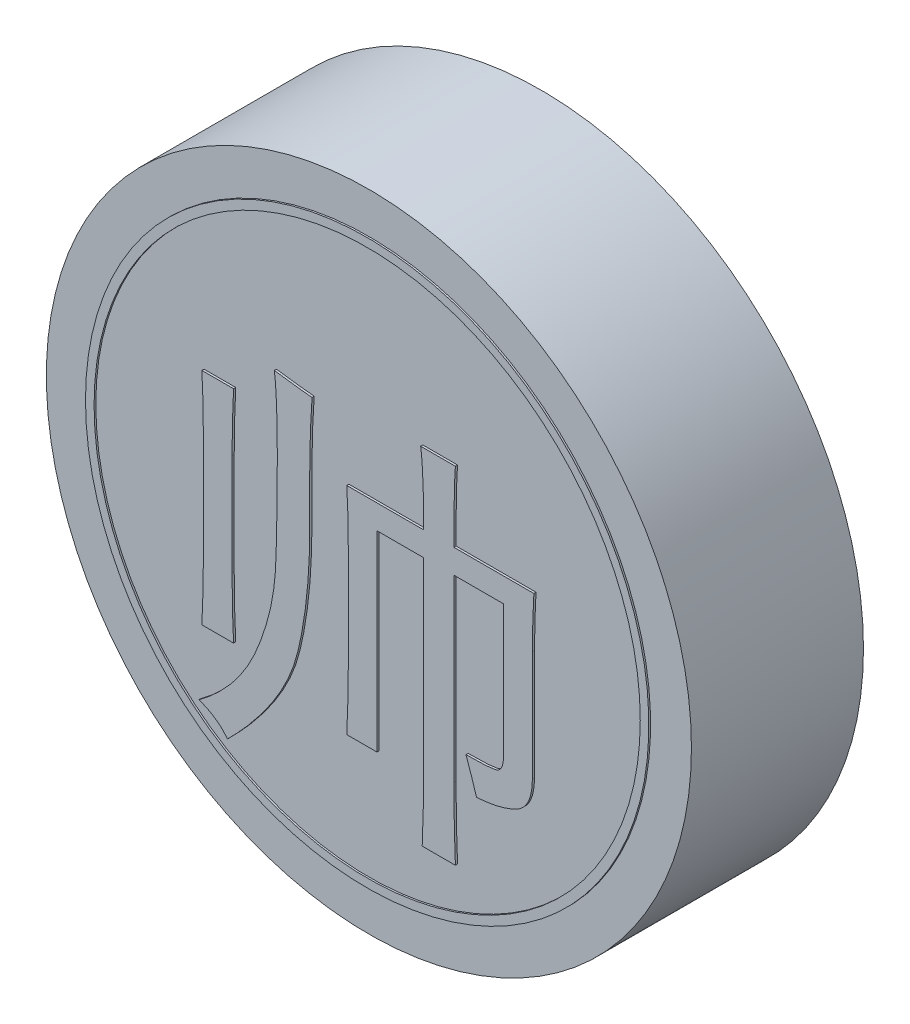
from build123d import *

# Parameters (mm, degrees)
SKETCH_1_R               = 15
DIAMETER30_HEIGHT8_DEPTH = 8
CHARACTER_DEPTH          = 0.1
SKETCH_3_R               = 13.1
SKETCH_3_R_2             = 12.7
INK_RING_DEPTH           = 0.08


with BuildPart() as part:
    # 草图1 → Diameter30_Height8 (new body)
    with BuildSketch(Plane.XY):
        Circle(SKETCH_1_R)
    extrude(amount=-DIAMETER30_HEIGHT8_DEPTH)

    # 草图2 → Character_帅 (add)
    with BuildSketch(Plane.XY):
        with BuildLine():
            add(Edge.make_bspline(
                [(2.649122807, 2.657894737), (2.648277509, 2.838961546), (2.646647548, 3.188106947), (2.643949337, 3.693304246), (2.627710858, 4.161013978), (2.618261471, 4.592706352), (2.59561766, 4.986803608), (2.573364544, 5.343905172), (2.545932395, 5.6629896), (2.520624442, 5.862638482), (2.50877193, 5.956140351)],
                knots=[0, 0, 0, 0, 1.315583411, 2.536797873, 3.670260287, 4.715635349, 5.673736592, 6.537953599, 7.315277556, 8, 8, 8, 8], degree=3))
            Line((2.50877193, 5.956140351), (4.122807018, 5.956140351))
            add(Edge.make_bspline(
                [(4.122807018, 5.956140351), (4.117499898, 5.877309705), (4.105781963, 5.703254378), (4.089167905, 5.417436401), (4.081123846, 5.081109437), (4.069497803, 4.693902375), (4.062208699, 4.256354693), (4.058010495, 3.768573009), (4.051072159, 3.230576781), (4.052096052, 2.854561793), (4.052631579, 2.657894737)],
                knots=[0, 0, 0, 0, 0.574688494, 1.268892212, 2.082186167, 3.021459211, 4.086593269, 5.265055303, 6.569542337, 8, 8, 8, 8], degree=3))
            Line((4.052631579, 2.657894737), (7.771929825, 2.657894737))
            add(Edge.make_bspline(
                [(7.771929825, 2.657894737), (7.760796072, 2.449999982), (7.73890673, 2.041271737), (7.719157498, 1.435549924), (7.705407242, 0.848123825), (7.702957274, 0.461670931), (7.701754386, 0.271929825)],
                knots=[0, 0, 0, 0, 1.046485867, 2.057427233, 3.046233291, 4, 4, 4, 4], degree=3))
            Line((7.701754386, 0.271929825), (7.701754386, -4.850877193))
            add(Edge.make_bspline(
                [(7.701754386, -4.850877193), (7.700509851, -4.946341409), (7.69812364, -5.129379766), (7.659319509, -5.390999722), (7.605347303, -5.628411903), (7.522536164, -5.840237206), (7.420768732, -6.029019154), (7.289859981, -6.189160821), (7.140756422, -6.328733562), (6.901013102, -6.472408104), (6.563626246, -6.612761018), (6.121927666, -6.749793211), (5.6299881, -6.842128832), (5.284963987, -6.870952514), (5.105263158, -6.885964912)],
                knots=[0, 0, 0, 0, 0.91195479, 1.748536932, 2.524193789, 3.235017793, 3.917413987, 4.565660724, 5.204897301, 5.860042995, 7.225363373, 8.690313679, 10.276197647, 12, 12, 12, 12], degree=3))
            add(Edge.make_bspline(
                [(5.105263158, -6.885964912), (5.030622329, -6.645449861), (4.877118075, -6.150813287), (4.703323003, -5.662931781), (4.614035088, -5.412280702)],
                knots=[0, 0, 0, 0, 0.972491982, 2, 2, 2, 2], degree=3))
            add(Edge.make_bspline(
                [(4.614035088, -5.412280702), (4.703272413, -5.411616614), (4.873964221, -5.410346357), (5.116579774, -5.405384501), (5.334043291, -5.397378419), (5.526579613, -5.38822529), (5.693812444, -5.372515338), (5.836088174, -5.354724862), (5.952359909, -5.334162259), (6.04894766, -5.312443399), (6.128856661, -5.275644675), (6.193160306, -5.21721386), (6.247720931, -5.142694696), (6.295806352, -5.050517957), (6.327140956, -4.938045189), (6.350107, -4.808315534), (6.366009975, -4.660655055), (6.367588242, -4.555491891), (6.368421053, -4.5)],
                knots=[0, 0, 0, 0, 1.810479571, 3.463057961, 4.922871987, 6.225442376, 7.372781237, 8.329861336, 9.133212, 9.768407665, 10.334419243, 10.894946083, 11.510128595, 12.201898471, 12.991479159, 13.867141808, 14.874545699, 16, 16, 16, 16], degree=3))
            Line((6.368421053, -4.5), (6.368421053, 1.535087719))
            Line((6.368421053, 1.535087719), (4.052631579, 1.535087719))
            Line((4.052631579, 1.535087719), (4.052631579, -6.815789474))
            add(Edge.make_bspline(
                [(4.052631579, -6.815789474), (4.053765197, -7.103428128), (4.056001813, -7.670936452), (4.069634056, -8.508736417), (4.088763125, -9.320656714), (4.11158118, -9.852421744), (4.122807018, -10.114035088)],
                knots=[0, 0, 0, 0, 1.046194404, 2.064131589, 3.047607535, 4, 4, 4, 4], degree=3))
            Line((4.122807018, -10.114035088), (2.578947368, -10.114035088))
            add(Edge.make_bspline(
                [(2.578947368, -10.114035088), (2.590173206, -9.852421744), (2.612991261, -9.320656714), (2.63212033, -8.508736417), (2.645752573, -7.670936452), (2.647989189, -7.103428128), (2.649122807, -6.815789474)],
                knots=[0, 0, 0, 0, 0.952392465, 1.935868411, 2.953805596, 4, 4, 4, 4], degree=3))
            Line((2.649122807, -6.815789474), (2.649122807, 1.535087719))
            Line((2.649122807, 1.535087719), (0.473684211, 1.535087719))
            Line((0.473684211, 1.535087719), (0.473684211, -7.377192982))
            Line((0.473684211, -7.377192982), (-0.929824561, -7.377192982))
            add(Edge.make_bspline(
                [(-0.929824561, -7.377192982), (-0.918712527, -7.137237676), (-0.89705509, -6.669562974), (-0.877305751, -5.985025613), (-0.863382791, -5.336096743), (-0.860869477, -4.914994784), (-0.859649123, -4.710526316)],
                knots=[0, 0, 0, 0, 1.08047164, 2.105847367, 3.080283338, 4, 4, 4, 4], degree=3))
            Line((-0.859649123, -4.710526316), (-0.859649123, 0.271929825))
            add(Edge.make_bspline(
                [(-0.859649123, 0.271929825), (-0.860778179, 0.479865427), (-0.863003576, 0.889711309), (-0.876691761, 1.495334741), (-0.895801581, 2.082918827), (-0.918599793, 2.468200268), (-0.929824561, 2.657894737)],
                knots=[0, 0, 0, 0, 1.045182189, 2.060078265, 3.044873733, 4, 4, 4, 4], degree=3))
            Line((-0.929824561, 2.657894737), (2.649122807, 2.657894737))
        make_face()
        with BuildLine():
            add(Edge.make_bspline(
                [(-2.543859649, 5.394736842), (-2.55453691, 5.241410089), (-2.576968973, 4.919282974), (-2.606332671, 4.4133937), (-2.625722602, 3.862230343), (-2.641455489, 3.266150249), (-2.651530629, 2.625004365), (-2.656494342, 1.938824334), (-2.656719765, 1.207587715), (-2.649857053, 0.442624259), (-2.646120363, -0.33291913), (-2.667300728, -1.096525685), (-2.709346485, -1.836581392), (-2.767619156, -2.554468791), (-2.849443973, -3.249377344), (-2.946107025, -3.921647543), (-3.067303461, -4.570685232), (-3.204881304, -5.204412609), (-3.386965023, -5.831459902), (-3.6329141, -6.458227284), (-3.948908402, -7.087582997), (-4.324035754, -7.726937374), (-4.768016313, -8.370052347), (-5.274742334, -9.020901708), (-5.843502049, -9.679758443), (-6.259926358, -10.105844174), (-6.473684211, -10.324561404)],
                knots=[0, 0, 0, 0, 0.659190093, 1.384905098, 2.173195898, 3.024385089, 3.942285353, 4.923260466, 5.96737447, 7.078396075, 8.204255659, 9.293363896, 10.354008229, 11.383098418, 12.381857005, 13.354528352, 14.295395268, 15.213084928, 16.134880166, 17.092610712, 18.096292209, 19.152239996, 20.269451564, 21.445260402, 22.688607657, 24, 24, 24, 24], degree=3))
            add(Edge.make_bspline(
                [(-6.473684211, -10.324561404), (-6.559732909, -10.223409926), (-6.732267206, -10.020593389), (-7.051816717, -9.772809488), (-7.40742211, -9.558009314), (-7.671581713, -9.461672847), (-7.807017544, -9.412280702)],
                knots=[0, 0, 0, 0, 0.970214787, 1.94535571, 2.94657452, 4, 4, 4, 4], degree=3))
            add(Edge.make_bspline(
                [(-7.807017544, -9.412280702), (-7.657973182, -9.300088741), (-7.363260789, -9.078246324), (-6.955815499, -8.710596291), (-6.57424992, -8.328429932), (-6.223348035, -7.926246582), (-5.904578485, -7.503232626), (-5.618396742, -7.059527971), (-5.360624691, -6.597131501), (-5.135263603, -6.115997615), (-4.940375439, -5.623171603), (-4.765347571, -5.126552857), (-4.614790167, -4.626941063), (-4.485965447, -4.124417421), (-4.385577394, -3.617432725), (-4.307679883, -3.107532014), (-4.251338798, -2.595099135), (-4.218416323, -1.902922648), (-4.195596224, -1.026008016), (-4.174639454, 0.042281327), (-4.161380369, 1.13219518), (-4.159064793, 1.86603464), (-4.157894737, 2.236842105)],
                knots=[0, 0, 0, 0, 0.876110196, 1.73237371, 2.575729557, 3.4124282, 4.237942316, 5.062170833, 5.891260029, 6.723431221, 7.556418375, 8.38034529, 9.196777122, 10.007322445, 10.81680406, 11.623928264, 12.430374722, 13.237591303, 14.878759917, 16.552082939, 18.25777509, 20, 20, 20, 20], degree=3))
            add(Edge.make_bspline(
                [(-4.157894737, 2.236842105), (-4.158742697, 2.42310712), (-4.160379489, 2.782648704), (-4.163043616, 3.302572137), (-4.179306434, 3.783279411), (-4.188638552, 4.224503155), (-4.21144322, 4.62552561), (-4.233545861, 4.986968321), (-4.261113513, 5.309505904), (-4.286397635, 5.510893979), (-4.298245614, 5.605263158)],
                knots=[0, 0, 0, 0, 1.325220203, 2.558031484, 3.6987413, 4.747031617, 5.69752876, 6.556083798, 7.323389997, 8, 8, 8, 8], degree=3))
            add(Edge.make_bspline(
                [(-4.298245614, 5.605263158), (-4.138880204, 5.583255195), (-3.828993721, 5.54046065), (-3.377518369, 5.48397261), (-2.952393963, 5.432706182), (-2.677341911, 5.407142736), (-2.543859649, 5.394736842)],
                knots=[0, 0, 0, 0, 1.092444961, 2.124262261, 3.089707881, 4, 4, 4, 4], degree=3))
        make_face()
        with BuildLine():
            add(Edge.make_bspline(
                [(-6.192982456, 3.921052632), (-6.213127144, 3.470616313), (-6.25390666, 2.558784097), (-6.260049539, 1.646058489), (-6.263157895, 1.184210526)],
                knots=[0, 0, 0, 0, 0.987980705, 2, 2, 2, 2], degree=3))
            Line((-6.263157895, 1.184210526), (-6.263157895, -3.51754386))
            add(Edge.make_bspline(
                [(-6.263157895, -3.51754386), (-6.262026133, -3.760132755), (-6.259790748, -4.239279455), (-6.246045202, -4.949726115), (-6.226937452, -5.6429749), (-6.204202458, -6.099339702), (-6.192982456, -6.324561404)],
                knots=[0, 0, 0, 0, 1.036632017, 2.04749195, 3.036413013, 4, 4, 4, 4], degree=3))
            Line((-6.192982456, -6.324561404), (-7.666666667, -6.324561404))
            add(Edge.make_bspline(
                [(-7.666666667, -6.324561404), (-7.655523902, -6.083740603), (-7.633604379, -5.610009217), (-7.61410139, -4.912465947), (-7.600135574, -4.241012646), (-7.597689835, -3.802584211), (-7.596491228, -3.587719298)],
                knots=[0, 0, 0, 0, 1.05657797, 2.078450635, 3.058287504, 4, 4, 4, 4], degree=3))
            Line((-7.596491228, -3.587719298), (-7.596491228, 1.254385965))
            add(Edge.make_bspline(
                [(-7.596491228, 1.254385965), (-7.597623519, 1.485712467), (-7.599858589, 1.94233606), (-7.613556549, 2.618130935), (-7.632693155, 3.27586782), (-7.655445944, 3.707961922), (-7.666666667, 3.921052632)],
                knots=[0, 0, 0, 0, 1.040483654, 2.053847617, 3.040239174, 4, 4, 4, 4], degree=3))
            Line((-7.666666667, 3.921052632), (-6.192982456, 3.921052632))
        make_face()
    extrude(amount=CHARACTER_DEPTH)

    # 草图3 → Ink_ring (add)
    with BuildSketch(Plane.XY):
        with Locations(Location((0, 0, 0), (0, 0, 180))):
            Circle(SKETCH_3_R)
        with Locations(Location((0, 0, 0), (0, 0, 180))):
            Circle(SKETCH_3_R_2, mode=Mode.SUBTRACT)
    extrude(amount=INK_RING_DEPTH)


solid = part.part
